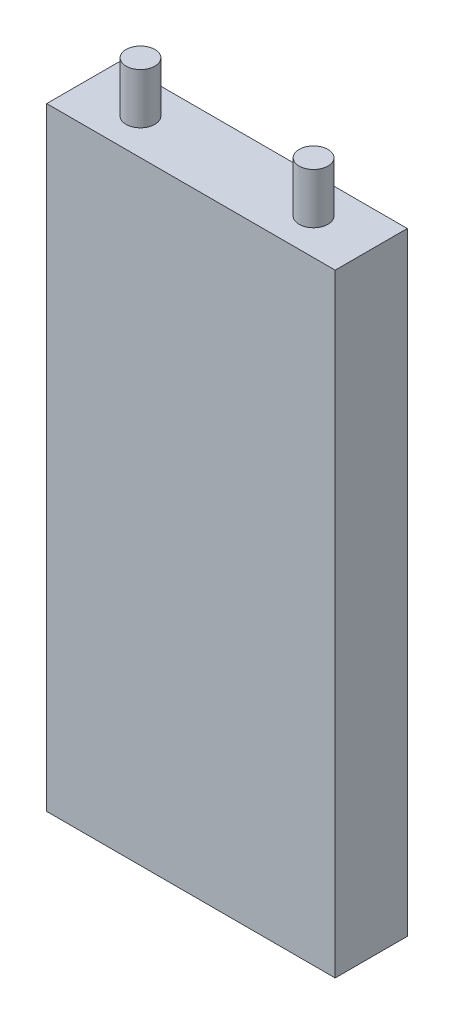
from build123d import *

# Parameters (mm, degrees)
SKETCH1_W           = 101.6
SKETCH1_H           = 25.4
BOSS_EXTRUDE1_DEPTH = 215.9
SKETCH3_R           = 5.207
CUT_EXTRUDE1_DEPTH  = 17.78
SKETCH4_R           = 5.08
BOSS_EXTRUDE3_DEPTH = 17.78


with BuildPart() as part:
    # Sketch1 → Boss-Extrude1 (new body)
    with BuildSketch(Plane(origin=(0, 0, 0), x_dir=(1, 0, 0), z_dir=(0, 1, 0))):
        with Locations((25.4, 12.7)):
            Rectangle(SKETCH1_W, SKETCH1_H)
    extrude(amount=BOSS_EXTRUDE1_DEPTH)

    # Sketch3 → Cut-Extrude1 (cut)
    with BuildSketch(Plane(origin=(0, 0, 0), x_dir=(-1, 0, 0), z_dir=(0, -1, 0))):
        with Locations(Location((5.08, 12.7, 0), (0, 0, 90))):
            Circle(SKETCH3_R)
        with Locations(Location((-55.88, 12.7, 0), (0, 0, 90))):
            Circle(SKETCH3_R)
    extrude(amount=-CUT_EXTRUDE1_DEPTH, mode=Mode.SUBTRACT)

    # Sketch4 → Boss-Extrude3 (add)
    with BuildSketch(Plane(origin=(0, 215.9, 0), x_dir=(1, 0, 0), z_dir=(0, 1, 0))):
        with Locations(Location((-5.08, 12.7, 0), (0, 0, 270))):
            Circle(SKETCH4_R)
        with Locations(Location((55.88, 12.7, 0), (0, 0, 270))):
            Circle(SKETCH4_R)
    extrude(amount=BOSS_EXTRUDE3_DEPTH)


solid = part.part
